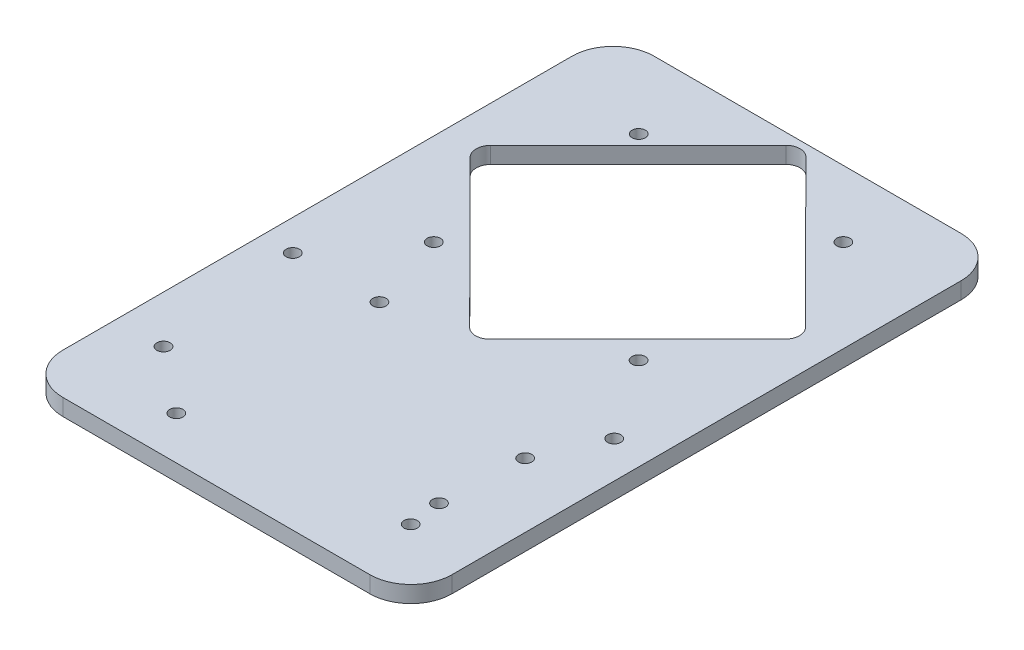
from build123d import *

# Parameters (mm, degrees)
SKETCH1_R           = 1.27
BOSS_EXTRUDE2_DEPTH = 3.175


with BuildPart() as part:
    # Sketch1 → Boss-Extrude2 (new body)
    with BuildSketch(Plane(origin=(0, 0, 0), x_dir=(1, 0, 0), z_dir=(0, 1, 0))):
        with BuildLine():
            ThreePointArc((-175.915621646, 29.519008442), (-181.461271413, 31.81826883), (-183.753097882, 37.366994908))
            Line((-183.753097882, 37.366994908), (-183.753097882, 134.805535228))
            ThreePointArc((-183.753097882, 134.805535228), (-181.458407426, 140.352437247), (-175.91562747, 142.657066645))
            Line((-175.91562747, 142.657066645), (-117.135020463, 142.660762281))
            ThreePointArc((-117.135020463, 142.660762281), (-111.588130828, 140.360246871), (-109.29759004, 134.809230866))
            Line((-109.29759004, 134.809230866), (-109.29759004, 37.37053719))
            ThreePointArc((-109.29759004, 37.37053719), (-111.597249567, 31.81866797), (-117.149118786, 29.519008442))
            Line((-117.149118786, 29.519008442), (-175.915621646, 29.519008442))
        make_face()
        with Locations(Location((-126.972959073, 129.95775743, 0), (0, 0, 270))):
            Circle(SKETCH1_R, mode=Mode.SUBTRACT)
        with Locations(Location((-164.472977249, 128.29201107, 0), (0, 0, 270))):
            Circle(SKETCH1_R, mode=Mode.SUBTRACT)
        with Locations(Location((-166.159897821, 90.761182378, 0), (0, 0, 270))):
            Circle(SKETCH1_R, mode=Mode.SUBTRACT)
        with Locations(Location((-126.972959075, 90.761489089, 0), (0, 0, 270))):
            Circle(SKETCH1_R, mode=Mode.SUBTRACT)
        with Locations(Location((-116.329373394, 75.456747577, 0), (0, 0, 270))):
            Circle(SKETCH1_R, mode=Mode.SUBTRACT)
        with Locations(Location((-121.602318573, 63.673415864, 0), (0, 0, 270))):
            Circle(SKETCH1_R, mode=Mode.SUBTRACT)
        with Locations(Location((-161.416515799, 75.608057078, 0), (0, 0, 270))):
            Circle(SKETCH1_R, mode=Mode.SUBTRACT)
        with Locations(Location((-177.85310358, 75.456747579, 0), (0, 0, 270))):
            Circle(SKETCH1_R, mode=Mode.SUBTRACT)
        with Locations(Location((-174.718127663, 47.58354115, 0), (0, 0, 270))):
            Circle(SKETCH1_R, mode=Mode.SUBTRACT)
        with Locations(Location((-122.379809257, 47.976111584, 0), (0, 0, 270))):
            Circle(SKETCH1_R, mode=Mode.SUBTRACT)
        with Locations(Location((-121.602318574, 41.767430359, 0), (0, 0, 270))):
            Circle(SKETCH1_R, mode=Mode.SUBTRACT)
        with Locations(Location((-162.435290361, 37.763153633, 0), (0, 0, 270))):
            Circle(SKETCH1_R, mode=Mode.SUBTRACT)
        with BuildLine():
            ThreePointArc((-144.679570761, 140.490425994), (-146.605093484, 141.290423511), (-148.531606371, 140.492813408))
            Line((-148.531606371, 140.492813408), (-176.798615575, 112.209681509))
            ThreePointArc((-176.798615575, 112.209681509), (-177.56091066, 110.280604208), (-176.801172002, 108.350518665))
            Line((-176.801172002, 108.350518665), (-148.569167296, 80.0322861))
            ThreePointArc((-148.569167296, 80.0322861), (-146.643487849, 79.232224846), (-144.71682032, 80.029903714))
            Line((-144.71682032, 80.029903714), (-116.449969407, 108.313038257))
            ThreePointArc((-116.449969407, 108.313038257), (-115.650538135, 110.242134618), (-116.447583058, 112.172218171))
            Line((-116.447583058, 112.172218171), (-144.679570761, 140.490425994))
        make_face(mode=Mode.SUBTRACT)
    extrude(amount=BOSS_EXTRUDE2_DEPTH)


solid = part.part
